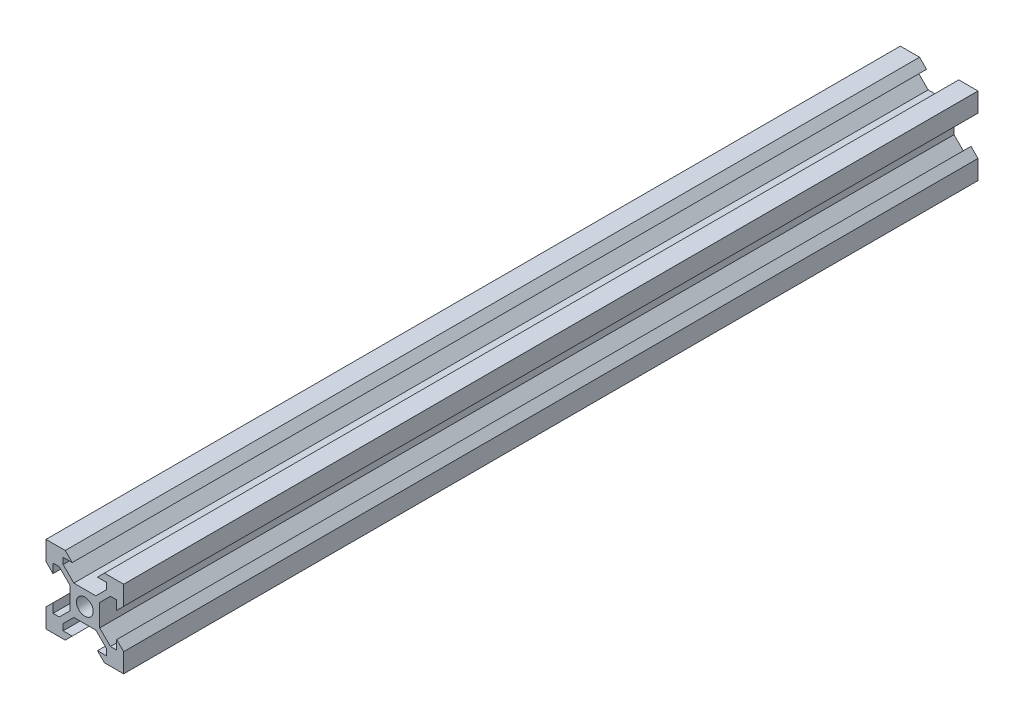
from build123d import *

# Parameters (mm, degrees)
CROQUIS1_R      = 2.15
BOSCHBASE_DEPTH = 220


with BuildPart() as part:
    # Croquis1 → BoschBase (new body)
    with BuildSketch(Plane.XY):
        Polygon((4.4, 0), (0, 0), (0, -0.56736664), (0, -4.4), (0, -4.95), (1.8, -6.75), (1.8, -4.4), (3.410050506, -4.4), (6.175, -7.164949494), (6.175, -12.835050506), (3.410050506, -15.6), (1.8, -15.6), (1.8, -13.25), (0, -15.05), (0, -15.6), (0, -20), (4.4, -20), (4.95, -20), (6.75, -18.2), (4.4, -18.2), (4.4, -16.589949494), (7.164949494, -13.825), (12.835050506, -13.825), (15.6, -16.589949494), (15.6, -18.2), (13.25, -18.2), (15.05, -20), (15.6, -20), (18.2, -20), (20, -20), (20, -15.6), (20, -15.05), (18.2, -13.25), (18.2, -15.6), (16.589949494, -15.6), (13.825, -12.835050506), (13.825, -7.164949494), (16.589949494, -4.4), (18.2, -4.4), (18.2, -6.75), (20, -4.95), (20, -4.4), (20, 0), (15.6, 0), (15.05, 0), (13.25, -1.8), (15.6, -1.8), (15.6, -3.410050506), (12.835050506, -6.175), (7.164949494, -6.175), (4.4, -3.410050506), (4.4, -1.8), (6.75, -1.8), (4.95, 0), align=None)
        with Locations((10, -10)):
            Circle(CROQUIS1_R, mode=Mode.SUBTRACT)
    extrude(amount=BOSCHBASE_DEPTH)


solid = part.part
